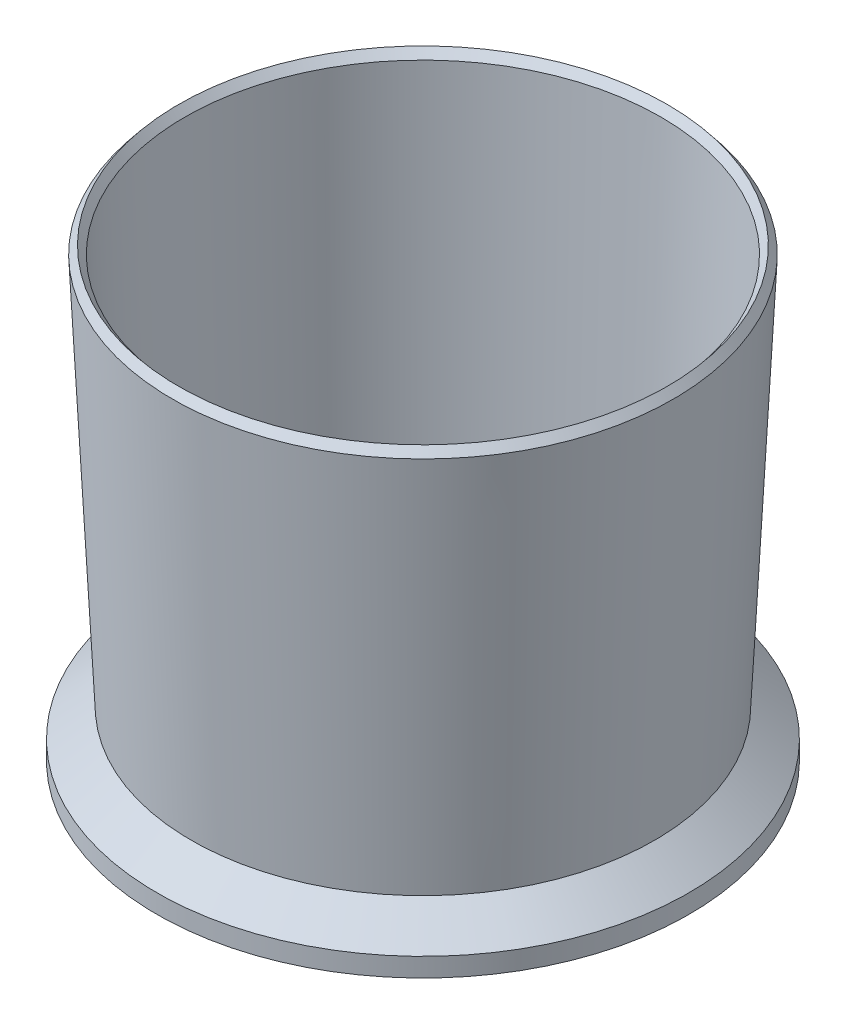
from build123d import *

# Parameters (mm, degrees)
SKETCH2_R                = 6.5
SIX_DRAINAGE_HOLES_DEPTH = 373.86056375


with BuildPart() as part:
    # Sketch1 → Planter Body + Central Socket (revolve)
    with BuildSketch(Plane.XY, mode=Mode.PRIVATE) as planter_body_central_socket_sk:
        Polygon((0, 0), (130, 0), (130, 10), (162, 10), (162, 0), (170, 0), (170, 12), (148, 30), (160, 280), (156, 285), (152, 280), (143, 18), (100, 18), (30, 80), (30, 100), (13.5, 100), (13.5, 8), (0, 8), align=None)
    revolve(planter_body_central_socket_sk.sketch.rotate(Axis((0, -10, 0), (0, 1, 0)), 90), axis=Axis((0, -10, 0), (0, 1, 0)))

    # Sketch2 → Six Drainage Holes (cut, through all)
    with BuildSketch(Plane(origin=(0, 0, 0), x_dir=(1, 0, 0), z_dir=(0, 1, 0))):
        with Locations(Location((118, 0, 0), (0, 0, 270))):
            Circle(SKETCH2_R)
        with Locations(Location((59, 102.190997647, 0), (0, 0, 270))):
            Circle(SKETCH2_R)
        with Locations(Location((-59, 102.190997647, 0), (0, 0, 270))):
            Circle(SKETCH2_R)
        with Locations(Location((-118, 0, 0), (0, 0, 270))):
            Circle(SKETCH2_R)
        with Locations(Location((-59, -102.190997647, 0), (0, 0, 270))):
            Circle(SKETCH2_R)
        with Locations(Location((59, -102.190997647, 0), (0, 0, 270))):
            Circle(SKETCH2_R)
    extrude(amount=SIX_DRAINAGE_HOLES_DEPTH, mode=Mode.SUBTRACT)


solid = part.part
